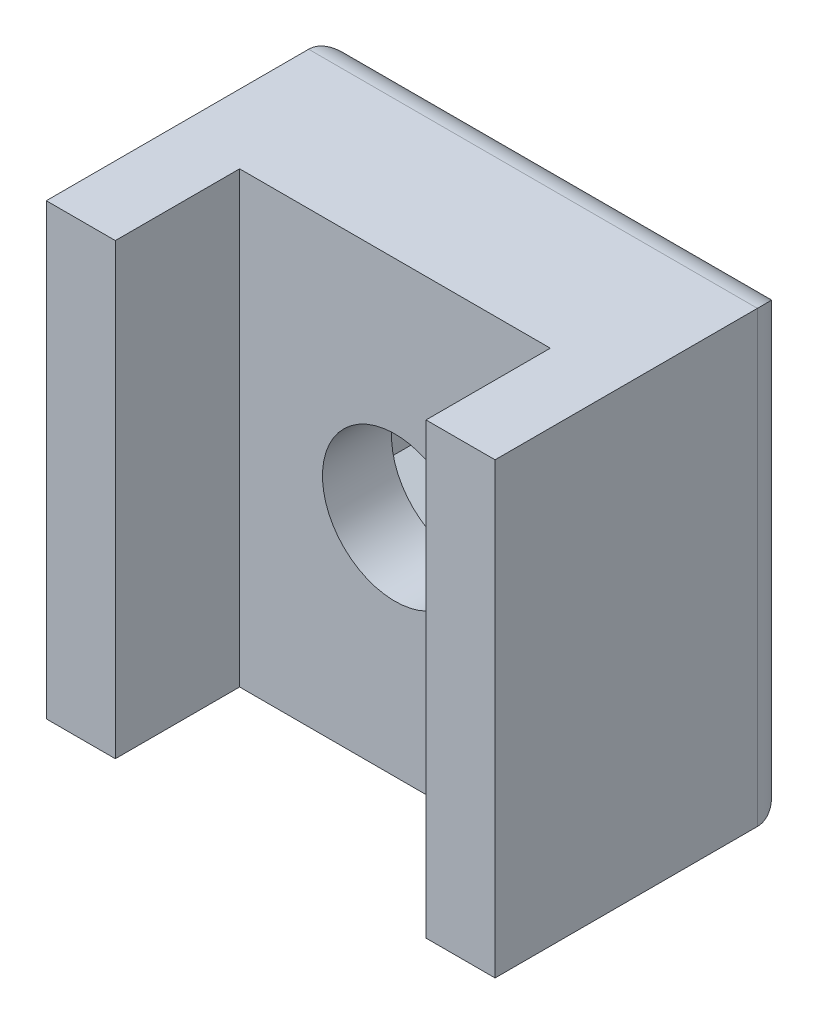
from build123d import *

# Parameters (mm, degrees)
ESQUISSE1_W             = 13
ESQUISSE1_H             = 13
BOSS_EXTRU_1_DEPTH      = 5.6
ESQUISSE2_W             = 9
ESQUISSE2_H             = 13
ENL_V_MAT_EXTRU_1_DEPTH = 3.6
ESQUISSE3_R             = 2.1
ENL_V_MAT_EXTRU_2_DEPTH = 10.872183143
ESQUISSE4_W             = 13
ESQUISSE4_H             = 13
BOSS_EXTRU_2_DEPTH      = 3
CONG_1_R                = 1


with BuildPart() as part:
    # Esquisse1 → Boss.-Extru.1 (new body)
    with BuildSketch(Plane.XY):
        Rectangle(ESQUISSE1_W, ESQUISSE1_H)
    extrude(amount=BOSS_EXTRU_1_DEPTH)

    # Esquisse2 → Enlèv. mat.-Extru.1 (cut)
    with BuildSketch(Plane.XY.offset(5.6)):
        Rectangle(ESQUISSE2_W, ESQUISSE2_H)
    extrude(amount=-ENL_V_MAT_EXTRU_1_DEPTH, mode=Mode.SUBTRACT)

    # Esquisse3 → Enlèv. mat.-Extru.2 (cut, through all)
    with BuildSketch(Plane.XY.offset(2)):
        Circle(ESQUISSE3_R)
    extrude(amount=-ENL_V_MAT_EXTRU_2_DEPTH, mode=Mode.SUBTRACT)

    # Esquisse4 → Boss.-Extru.2 (add)
    with BuildSketch(Plane(origin=(0, 0, 0), x_dir=(-1, 0, 0), z_dir=(0, 0, -1))):
        Rectangle(ESQUISSE4_W, ESQUISSE4_H)
        Polygon((-3.75, -2.165063509), (0, -4.330127019), (3.75, -2.165063509), (3.75, 2.165063509), (0, 4.330127019), (-3.75, 2.165063509), align=None, mode=Mode.SUBTRACT)
    extrude(amount=BOSS_EXTRU_2_DEPTH)

    # Congé1
    cong_1_edges = [part.edges().sort_by_distance(p)[0] for p in [
        (6.5, 0, -3),
        (0, -6.5, -3),
        (-6.5, 0, -3),
        (0, 6.5, -3),
    ]]
    fillet(cong_1_edges, radius=CONG_1_R)


solid = part.part
